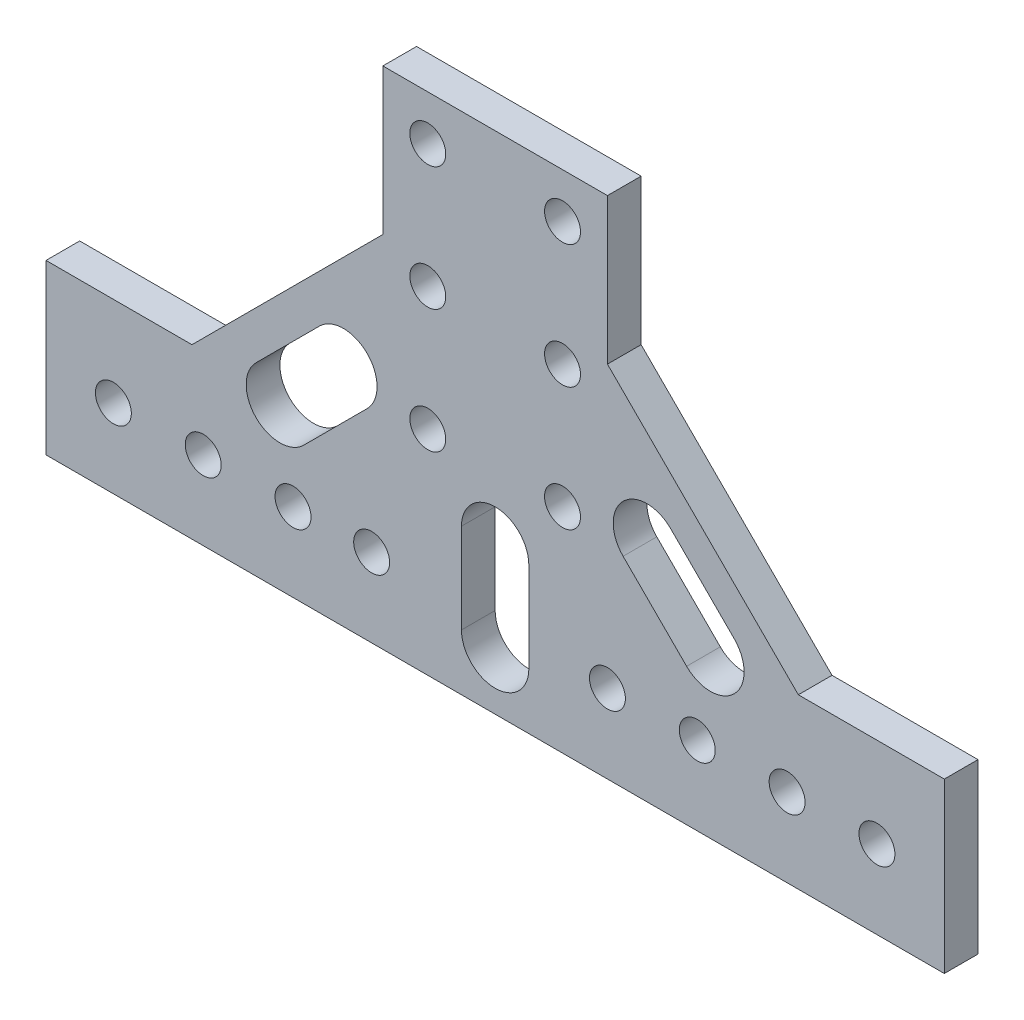
from build123d import *

# Parameters (mm, degrees)
EXTRUDE_1_DEPTH     = 3
SKETCH_3_R          = 1.6
CUT_EXTRUDE_1_DEPTH = 92.836811791


with BuildPart() as part:
    # 草图1 → 凸台-拉伸1 (new body)
    with BuildSketch(Plane.XY):
        Polygon((0, 0), (0, 15), (13, 15), (30, 32), (30, 45), (50, 45), (50, 32), (67, 15), (80, 15), (80, 0), align=None)
    extrude(amount=EXTRUDE_1_DEPTH)

    # 草图3 → 切除-拉伸1 (cut, through all)
    with BuildSketch(Plane(origin=(0, 0, 0), x_dir=(-1, 0, 0), z_dir=(0, 0, -1))):
        with Locations((-46, 41)):
            Circle(SKETCH_3_R)
        with Locations((-34, 41)):
            Circle(SKETCH_3_R)
        with Locations((-46, 19)):
            Circle(SKETCH_3_R)
        with Locations((-34, 19)):
            Circle(SKETCH_3_R)
        with Locations((-34, 30)):
            Circle(SKETCH_3_R)
        with Locations((-46, 30)):
            Circle(SKETCH_3_R)
        with Locations((-74, 7)):
            Circle(SKETCH_3_R)
        with Locations((-66, 7)):
            Circle(SKETCH_3_R)
        with Locations((-58, 7)):
            Circle(SKETCH_3_R)
        with Locations((-50, 7)):
            Circle(SKETCH_3_R)
        with Locations((-6, 7)):
            Circle(SKETCH_3_R)
        with Locations((-14, 7)):
            Circle(SKETCH_3_R)
        with Locations((-22, 7)):
            Circle(SKETCH_3_R)
        with Locations((-29, 7)):
            Circle(SKETCH_3_R)
        with BuildLine():
            Line((-61.292893219, 16.464466094), (-55.636038969, 22.121320344))
            ThreePointArc((-55.636038969, 22.121320344), (-51.393398282, 22.121320344), (-51.393398282, 17.878679656))
            Line((-51.393398282, 17.878679656), (-57.050252532, 12.221825407))
            ThreePointArc((-57.050252532, 12.221825407), (-61.292893219, 12.221825407), (-61.292893219, 16.464466094))
        make_face()
        with BuildLine():
            Line((-22.949747468, 12.221825407), (-28.606601718, 17.878679656))
            ThreePointArc((-28.606601718, 17.878679656), (-28.606601718, 22.121320344), (-24.363961031, 22.121320344))
            Line((-24.363961031, 22.121320344), (-18.707106781, 16.464466094))
            ThreePointArc((-18.707106781, 16.464466094), (-18.707106781, 12.221825407), (-22.949747468, 12.221825407))
        make_face()
        with BuildLine():
            Line((-43, 5), (-43, 13))
            ThreePointArc((-43, 13), (-40, 16), (-37, 13))
            Line((-37, 13), (-37, 5))
            ThreePointArc((-37, 5), (-40, 2), (-43, 5))
        make_face()
    extrude(amount=-CUT_EXTRUDE_1_DEPTH, mode=Mode.SUBTRACT)


solid = part.part
